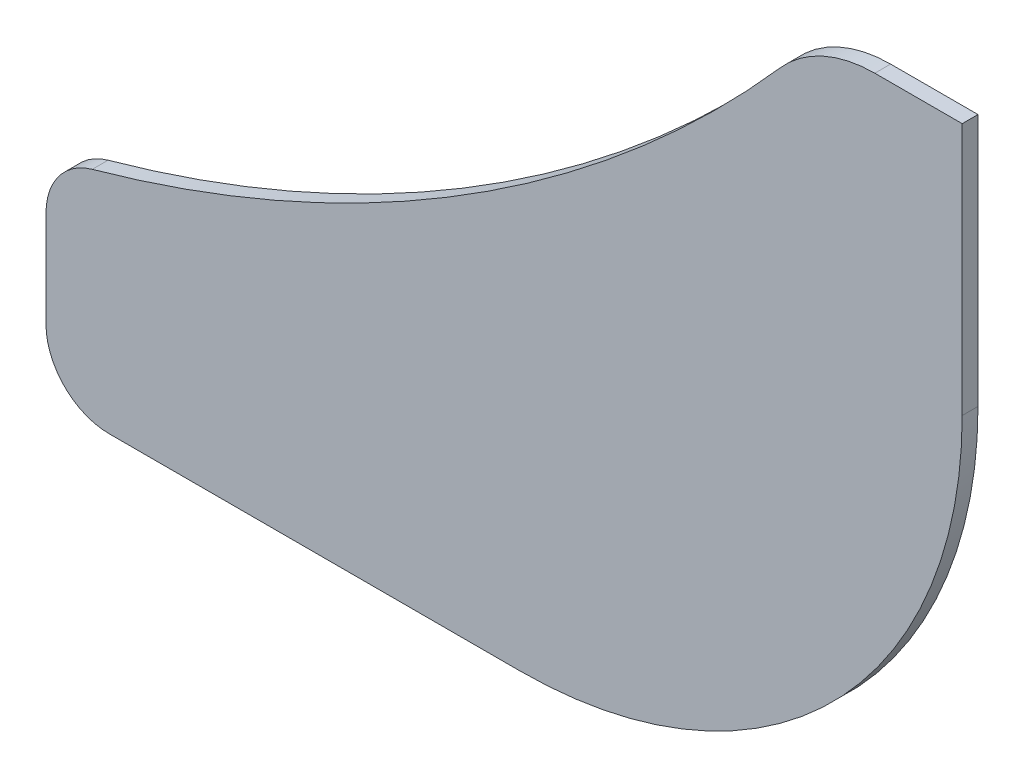
from build123d import *

# Parameters (mm, degrees)
BOSS_EXTRUDE1_DEPTH = 6.35
FILLET1_R           = 25.4


with BuildPart() as part:
    # Sketch1 → Boss-Extrude1 (new body)
    with BuildSketch(Plane.XY):
        with BuildLine():
            Line((203.2, -203.2), (203.2, -261.62))
            ThreePointArc((203.2, -261.62), (210.639487758, -279.580512242), (228.6, -287.02))
            Line((228.6, -287.02), (393.671225938, -287.02))
            ThreePointArc((393.671225938, -287.02), (519.394811633, -234.943585695), (571.471225938, -109.22))
            Line((571.471225938, -109.22), (571.471225938, -7.62))
            Line((571.471225938, -7.62), (536.346383071, -7.62))
            ThreePointArc((536.346383071, -7.62), (515.412320101, -12.133878888), (498.198486458, -24.873346158))
            ThreePointArc((498.198486458, -24.873346158), (364.438041528, -136.764204924), (203.2, -203.2))
        make_face()
    extrude(amount=BOSS_EXTRUDE1_DEPTH)

    # Fillet1
    fillet1_edges = [part.edges().sort_by_distance(p)[0] for p in [
        (203.2, -203.2, 3.175),
    ]]
    fillet(fillet1_edges, radius=FILLET1_R)


solid = part.part
